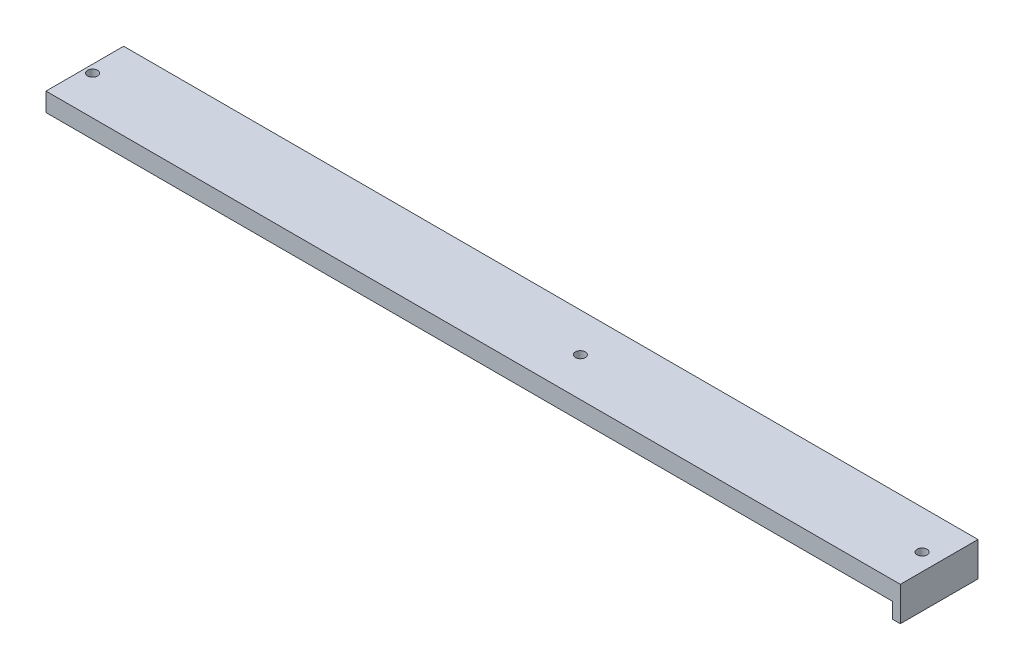
from build123d import *

# Parameters (mm, degrees)
SKETCH1_W           = 275
SKETCH1_H           = 25
SKETCH1_R           = 1.6
BOSS_EXTRUDE1_DEPTH = 6
SKETCH2_W           = 2.5
SKETCH2_H           = 25
BOSS_EXTRUDE2_DEPTH = 5


with BuildPart() as part:
    # Sketch1 → Boss-Extrude1 (new body)
    with BuildSketch(Plane(origin=(0, 0, 0), x_dir=(1, 0, 0), z_dir=(0, 1, 0))):
        Rectangle(SKETCH1_W, SKETCH1_H)
        with Locations(Location((-135, 0, 0), (0, 0, 270))):
            Circle(SKETCH1_R, mode=Mode.SUBTRACT)
        with Locations(Location((132, 0, 0), (0, 0, 270))):
            Circle(SKETCH1_R, mode=Mode.SUBTRACT)
        with Locations(Location((22, 0, 0), (0, 0, 270))):
            Circle(SKETCH1_R, mode=Mode.SUBTRACT)
    extrude(amount=BOSS_EXTRUDE1_DEPTH)

    # Sketch2 → Boss-Extrude2 (add)
    with BuildSketch(Plane(origin=(0, 0, 0), x_dir=(-1, 0, 0), z_dir=(0, -1, 0))):
        with Locations((-136.25, 0)):
            Rectangle(SKETCH2_W, SKETCH2_H)
    extrude(amount=BOSS_EXTRUDE2_DEPTH)


solid = part.part
